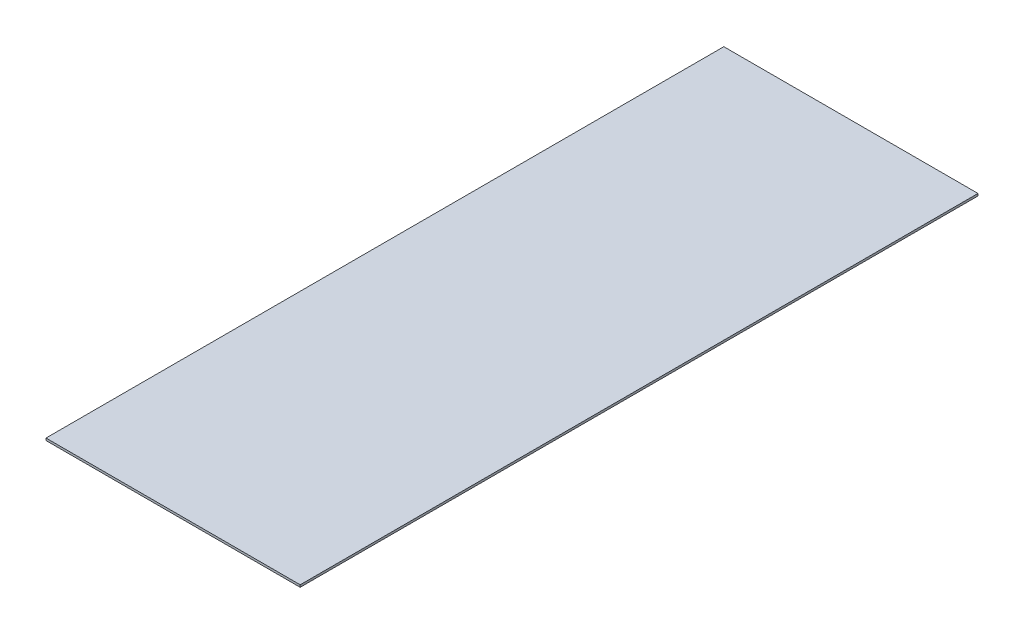
from build123d import *

# Parameters (mm, degrees)
CROQUIS1_W              = 914.4
CROQUIS1_H              = 2438.4
SALIENTE_EXTRUIR1_DEPTH = 7.9


with BuildPart() as part:
    # Croquis1 → Saliente-Extruir1 (new body)
    with BuildSketch(Plane(origin=(0, 0, 0), x_dir=(1, 0, 0), z_dir=(0, 1, 0))):
        Rectangle(CROQUIS1_W, CROQUIS1_H)
    extrude(amount=SALIENTE_EXTRUIR1_DEPTH)


solid = part.part
